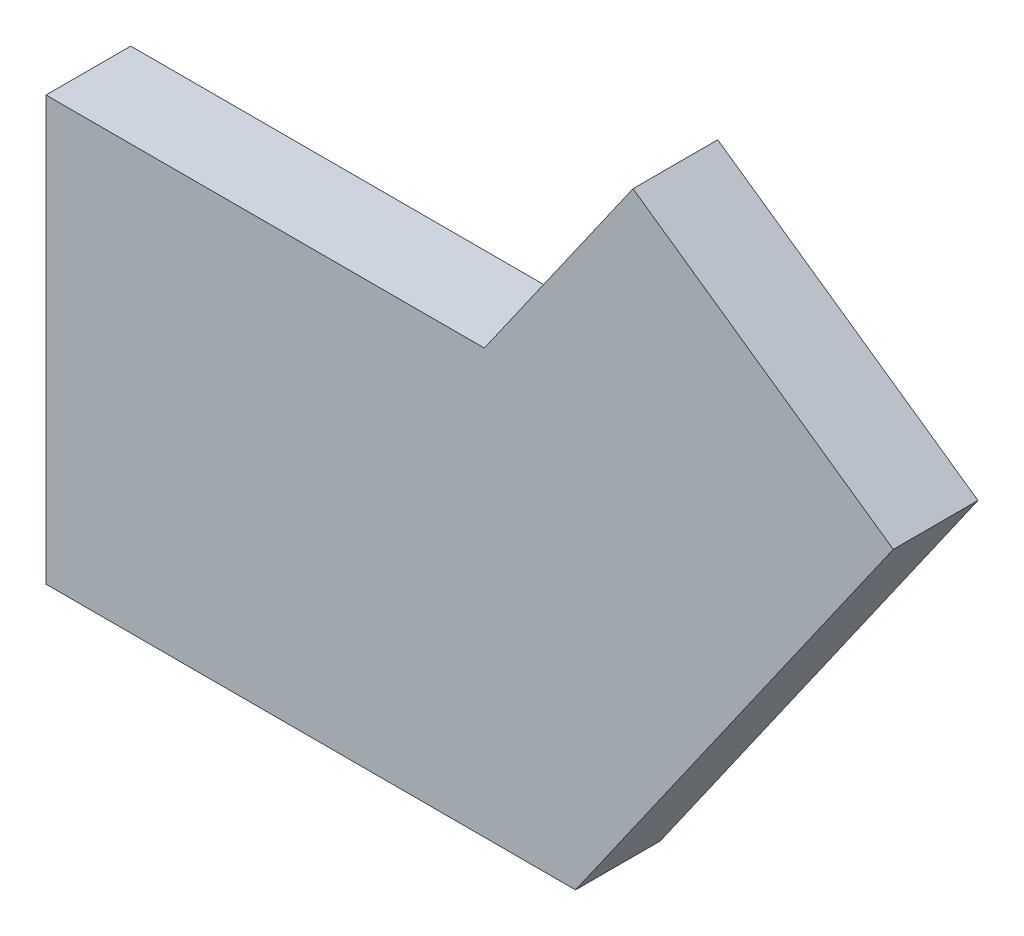
from build123d import *

# Parameters (mm, degrees)
BOSS_EXTRUDE1_DEPTH = 20


with BuildPart() as part:
    # Sketch1 → Boss-Extrude1 (new body)
    with BuildSketch(Plane.XY):
        Polygon((0, 0), (-125, 0), (-125, 100), (-21.537340336, 100), (13.563596678, 150.129333232), (75, 107.111100506), align=None)
    extrude(amount=BOSS_EXTRUDE1_DEPTH)


solid = part.part
